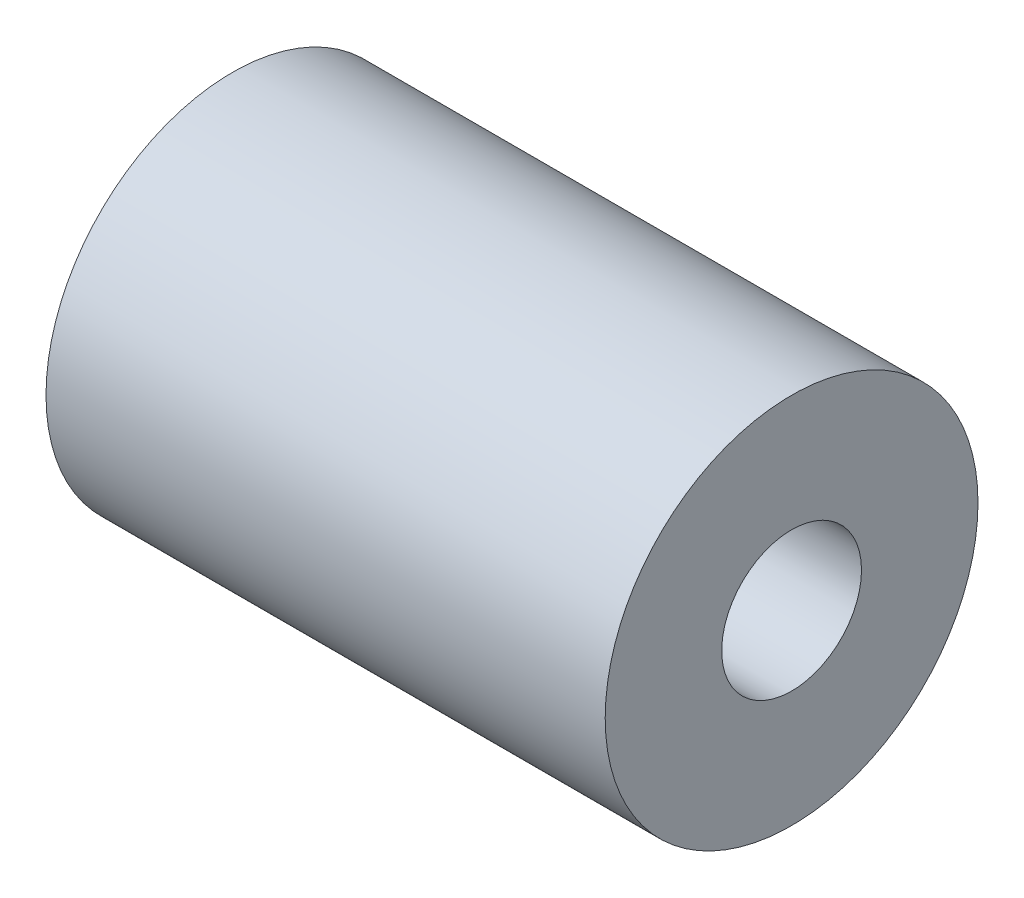
from build123d import *

# Parameters (mm, degrees)
CROQUIS1_R              = 4
CROQUIS1_R_2            = 1.5
SALIENTE_EXTRUIR1_DEPTH = 12


with BuildPart() as part:
    # Croquis1 → Saliente-Extruir1 (new body)
    with BuildSketch(Plane(origin=(0, 0, 0), x_dir=(0, 0, -1), z_dir=(1, 0, 0))):
        Circle(CROQUIS1_R)
        Circle(CROQUIS1_R_2, mode=Mode.SUBTRACT)
    extrude(amount=SALIENTE_EXTRUIR1_DEPTH)


solid = part.part
